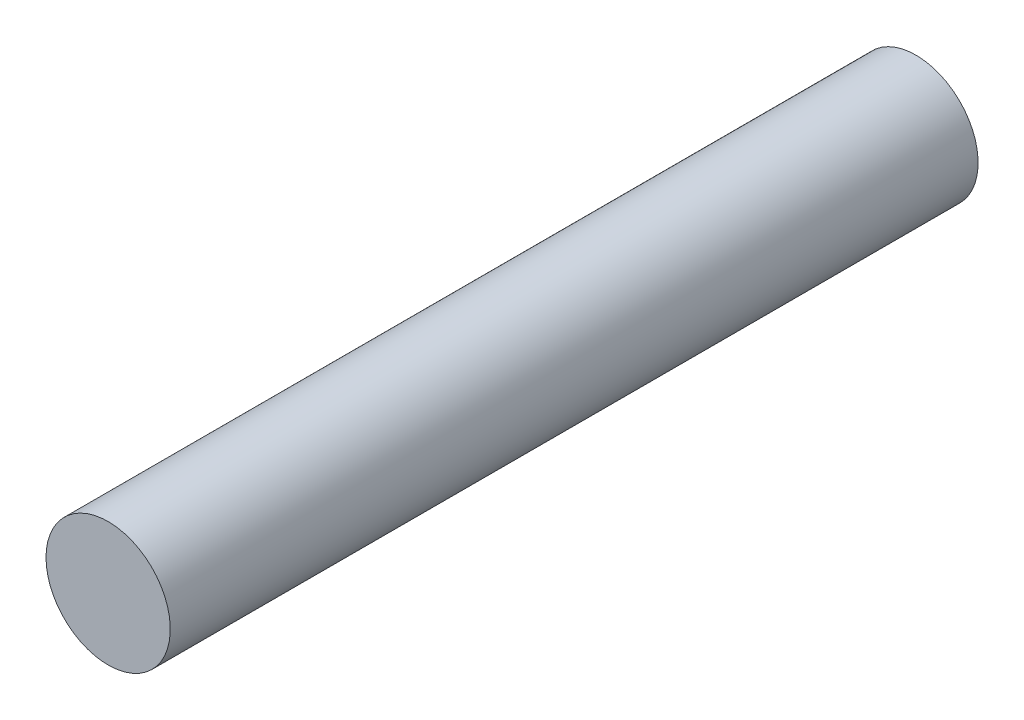
from build123d import *

# Parameters (mm, degrees)
SCHIZZO1_R                   = 1
ESTRUSIONE_ESTRUSIONE1_DEPTH = 13


with BuildPart() as part:
    # Schizzo1 → Estrusione-Estrusione1 (new body)
    with BuildSketch(Plane.XY):
        with Locations(Location((0, 0, 0), (0, 0, 180))):
            Circle(SCHIZZO1_R)
    extrude(amount=ESTRUSIONE_ESTRUSIONE1_DEPTH)


solid = part.part
